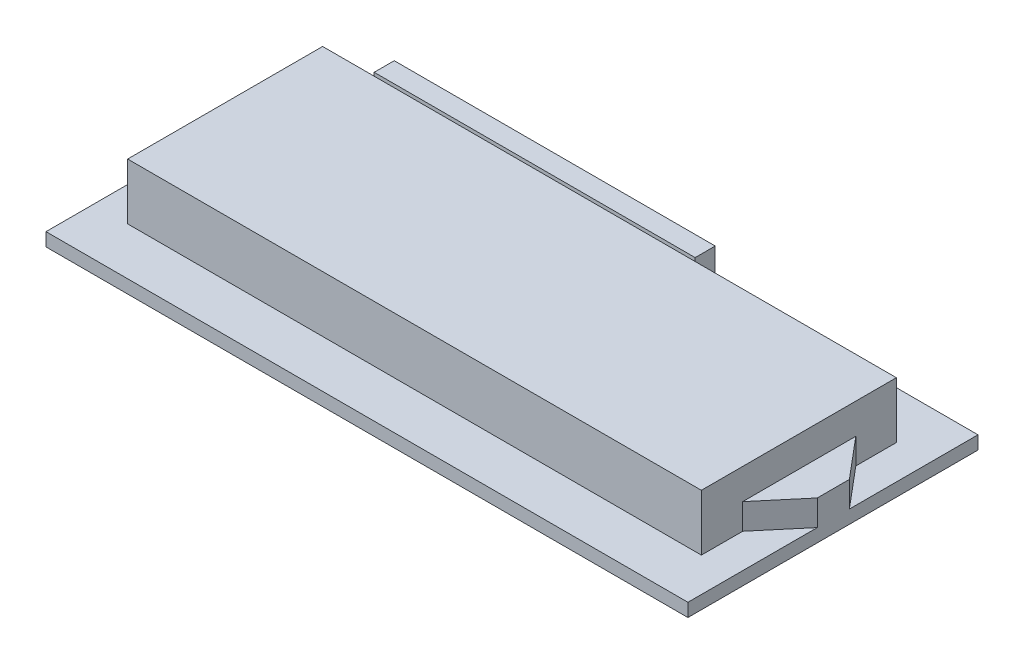
from build123d import *

# Parameters (mm, degrees)
BOSS_EXTRUDE2_DEPTH = 1.65
BOSS_EXTRUDE3_DEPTH = 7
BOSS_EXTRUDE4_DEPTH = 3.2
SKETCH7_W           = 40
SKETCH7_H           = 2.5
BOSS_EXTRUDE5_DEPTH = 4
SKETCH8_W           = 40
SKETCH8_H           = 19.15
BOSS_EXTRUDE6_DEPTH = 11.1
SKETCH9_W           = 4.8
SKETCH9_H           = 2.5
BOSS_EXTRUDE7_DEPTH = 6


with BuildPart() as part:
    # Sketch3 → Boss-Extrude2 (new body)
    with BuildSketch(Plane(origin=(0, 0, 0), x_dir=(1, 0, 0), z_dir=(0, 1, 0))):
        Polygon((0, 0), (0, 36.15), (80, 36.15), (80, 20.120748629), (80, 16.120748629), (80, 0), align=None)
    extrude(amount=-BOSS_EXTRUDE2_DEPTH)

    # Sketch5 → Boss-Extrude3 (add)
    with BuildSketch(Plane(origin=(0, 0, 0), x_dir=(1, 0, 0), z_dir=(0, 1, 0))):
        Polygon((75.75, 11.070748629), (75.75, 5.925), (4.25, 5.925), (4.25, 30.225), (75.75, 30.225), (75.75, 25.170748629), align=None)
    extrude(amount=BOSS_EXTRUDE3_DEPTH)

    # Sketch6 → Boss-Extrude4 (add)
    with BuildSketch(Plane(origin=(0, 0, 0), x_dir=(1, 0, 0), z_dir=(0, 1, 0))):
        Polygon((80, 20.120748629), (80, 16.120748629), (75.75, 11.070748629), (75.75, 25.170748629), align=None)
    extrude(amount=BOSS_EXTRUDE4_DEPTH)

    # Sketch7 → Boss-Extrude5 (add)
    with BuildSketch(Plane(origin=(0, 0, 0), x_dir=(1, 0, 0), z_dir=(0, 1, 0))):
        with Locations((27.25, 34.9)):
            Rectangle(SKETCH7_W, SKETCH7_H)
    extrude(amount=BOSS_EXTRUDE5_DEPTH)

    # Sketch8 → Boss-Extrude6 (add)
    with BuildSketch(Plane.XZ.offset(1.65)):
        with Locations((27.25, -26.575)):
            Rectangle(SKETCH8_W, SKETCH8_H)
    extrude(amount=BOSS_EXTRUDE6_DEPTH)

    # Sketch9 → Boss-Extrude7 (add)
    with BuildSketch(Plane(origin=(47.25, 0, 0), x_dir=(0, 0, -1), z_dir=(1, 0, 0))):
        with Locations((26.575, -11.5)):
            Rectangle(SKETCH9_W, SKETCH9_H)
    extrude(amount=BOSS_EXTRUDE7_DEPTH)


solid = part.part
